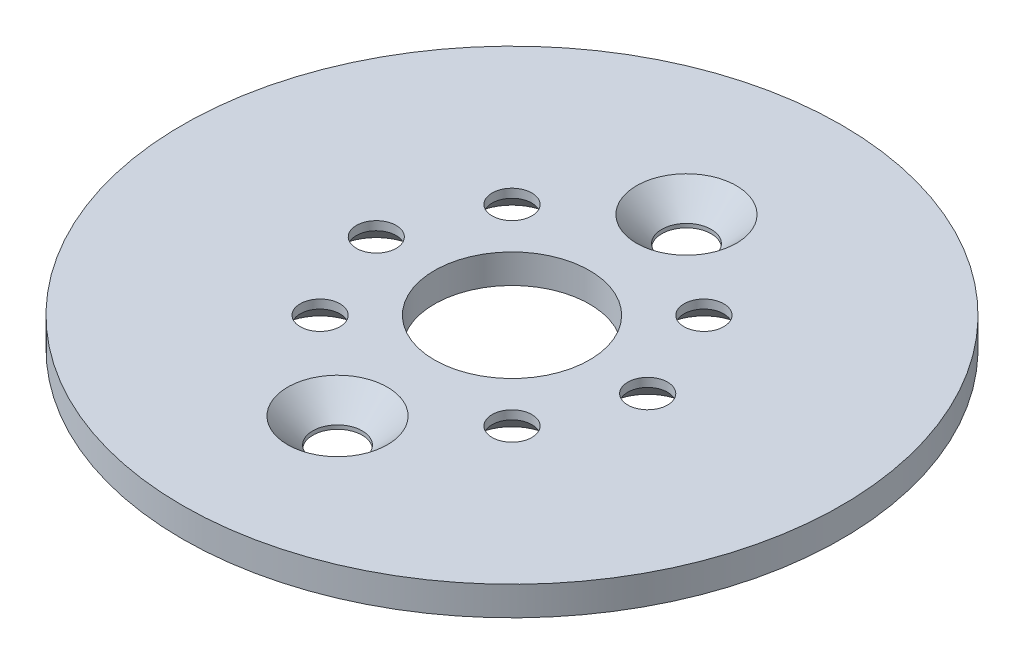
from build123d import *

# Parameters (mm, degrees)
SKETCH_1_R          = 34
SKETCH_1_R_2        = 8
SKETCH_1_R_3        = 2.05
EXTRUDE_1_DEPTH     = 3
SKETCH_2_R          = 2.55
CUT_EXTRUDE_1_DEPTH = 10
CHAMFER_1_SIZE      = 2.1
CHAMFER_2_SIZE      = 2.6


with BuildPart() as part:
    # 草图1 → 凸台-拉伸1 (new body)
    with BuildSketch(Plane(origin=(0, 0, 0), x_dir=(1, 0, 0), z_dir=(0, 1, 0))):
        with Locations(Location((0, 0, 0), (0, 0, 270))):
            Circle(SKETCH_1_R)
        with Locations(Location((0, 0, 0), (0, 0, 270))):
            Circle(SKETCH_1_R_2, mode=Mode.SUBTRACT)
        with Locations(Location((9.899494937, 9.899494937, 0), (0, 0, 270))):
            Circle(SKETCH_1_R_3, mode=Mode.SUBTRACT)
        with Locations(Location((14, 0, 0), (0, 0, 270))):
            Circle(SKETCH_1_R_3, mode=Mode.SUBTRACT)
        with Locations(Location((9.899494937, -9.899494937, 0), (0, 0, 270))):
            Circle(SKETCH_1_R_3, mode=Mode.SUBTRACT)
        with Locations(Location((-9.899494937, -9.899494937, 0), (0, 0, 270))):
            Circle(SKETCH_1_R_3, mode=Mode.SUBTRACT)
        with Locations(Location((-14, 0, 0), (0, 0, 270))):
            Circle(SKETCH_1_R_3, mode=Mode.SUBTRACT)
        with Locations(Location((-9.899494937, 9.899494937, 0), (0, 0, 270))):
            Circle(SKETCH_1_R_3, mode=Mode.SUBTRACT)
    extrude(amount=EXTRUDE_1_DEPTH)

    # 草图2 → 切除-拉伸1 (cut)
    with BuildSketch(Plane(origin=(0, 0, 0), x_dir=(-1, 0, 0), z_dir=(0, -1, 0))):
        with Locations(Location((0, 18, 0), (0, 0, 90))):
            Circle(SKETCH_2_R)
        with Locations(Location((0, -18, 0), (0, 0, 90))):
            Circle(SKETCH_2_R)
    extrude(amount=-CUT_EXTRUDE_1_DEPTH, mode=Mode.SUBTRACT)

    # 倒角1
    chamfer_1_edges = [part.edges().sort_by_distance(p)[0] for p in [
        (-9.899494937, 0, 7.849494937),
        (9.899494937, 0, -11.949494937),
        (14, 0, -2.05),
        (9.899494937, 0, 7.849494937),
        (-9.899494937, 0, -11.949494937),
        (-14, 0, -2.05),
    ]]
    chamfer(chamfer_1_edges, length=CHAMFER_1_SIZE)

    # 倒角2
    chamfer_2_edges = [part.edges().sort_by_distance(p)[0] for p in [
        (0, 3, -15.45),
        (0, 3, 20.55),
    ]]
    chamfer(chamfer_2_edges, length=CHAMFER_2_SIZE)


solid = part.part
